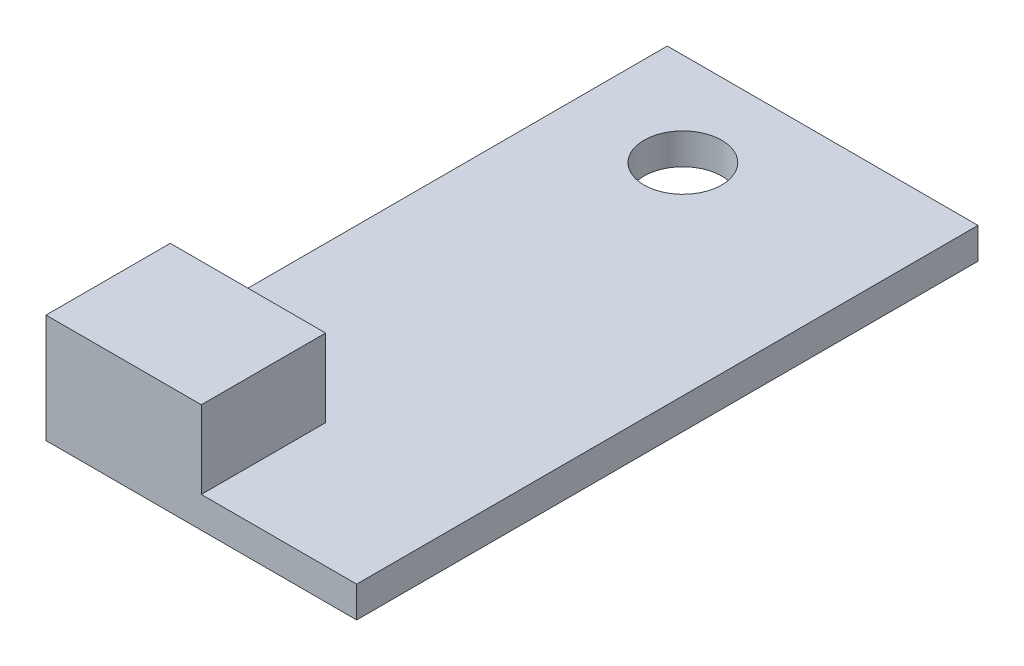
from build123d import *

# Parameters (mm, degrees)
SKETCH1_W                  = 100
SKETCH1_H                  = 200
BOSS_EXTRUDE1_DEPTH        = 10
SKETCH2_W                  = 50
SKETCH2_H                  = 40
BOSS_EXTRUDE2_DEPTH        = 25
F_25_0_25_DIAMETER_HOLE1_D = 25


with BuildPart() as part:
    # Sketch1 → Boss-Extrude1 (new body)
    with BuildSketch(Plane(origin=(0, 0, 0), x_dir=(1, 0, 0), z_dir=(0, 1, 0))):
        with Locations((50, 100)):
            Rectangle(SKETCH1_W, SKETCH1_H)
    extrude(amount=BOSS_EXTRUDE1_DEPTH)

    # Sketch2 → Boss-Extrude2 (add)
    with BuildSketch(Plane(origin=(0, 10, 0), x_dir=(1, 0, 0), z_dir=(0, 1, 0))):
        with Locations((25, 20)):
            Rectangle(SKETCH2_W, SKETCH2_H)
    extrude(amount=BOSS_EXTRUDE2_DEPTH)

    # Ø25.0 (25) Diameter Hole1 (through all)
    with Locations(Plane(origin=(0, 10, 0), x_dir=(1, 0, 0), z_dir=(0, 1, 0))):
        with Locations((35, 170)):
            Hole(F_25_0_25_DIAMETER_HOLE1_D / 2)


solid = part.part
